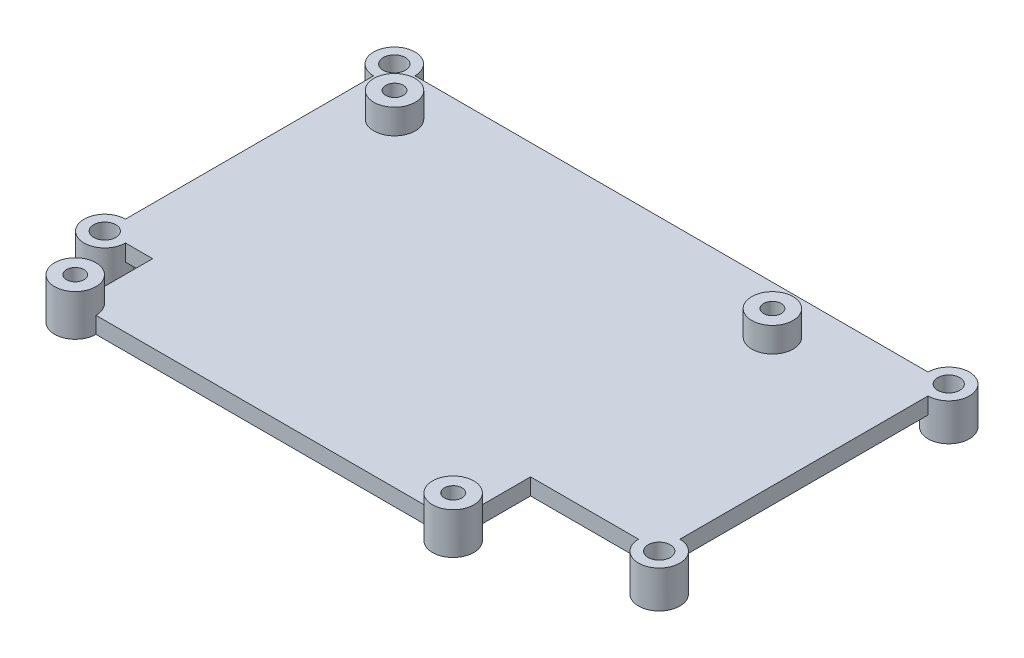
from build123d import *

# Parameters (mm, degrees)
SKETCH3_R           = 1.7
SKETCH3_R_2         = 1.35
BOSS_EXTRUDE2_DEPTH = 2.54
BOSS_EXTRUDE3_START = -3.175
SKETCH3_3_R         = 1.7
SKETCH3_3_R_2       = 3.175
BOSS_EXTRUDE3_DEPTH = 3.175
SKETCH3_4_R         = 3.175
SKETCH3_4_R_2       = 1.35
BOSS_EXTRUDE4_DEPTH = 6.35


with BuildPart() as part:
    # Sketch3 → Boss-Extrude2 (new body)
    with BuildSketch(Plane(origin=(0, 0, 0), x_dir=(1, 0, 0), z_dir=(0, 1, 0))):
        with BuildLine():
            Line((96.195997268, -106.660124546), (100.361892412, -106.660124546))
            Line((100.361892412, -106.660124546), (100.361892412, -115.360172993))
            ThreePointArc((100.361892412, -115.360172993), (98.116828382, -120.780237023), (103.536892412, -118.535172993))
            Line((103.536892412, -118.535172993), (155.186892412, -118.535172993))
            ThreePointArc((155.186892412, -118.535172993), (160.606956442, -120.780237023), (158.361892412, -115.360172993))
            Line((158.361892412, -115.360172993), (158.361892412, -106.660124546))
            Line((158.361892412, -106.660124546), (174.935999752, -106.660124546))
            ThreePointArc((174.935999752, -106.660124546), (180.356063783, -108.905188576), (178.110999752, -103.485124546))
            Line((178.110999752, -103.485124546), (178.110999752, -65.396123892))
            ThreePointArc((178.110999752, -65.396123892), (180.351769569, -59.973882777), (174.933888023, -62.225172993))
            Line((174.933888023, -62.225172993), (96.193885538, -62.225172993))
            ThreePointArc((96.193885538, -62.225172993), (90.773821508, -59.980108963), (93.018885538, -65.400172993))
            Line((93.018885538, -65.400172993), (93.018885538, -103.489173646))
            ThreePointArc((93.018885538, -103.489173646), (90.776683465, -108.90998437), (96.195999849, -106.664172943))
            Line((96.195999849, -106.664172943), (96.195999845, -106.664021883))
            ThreePointArc((96.195999845, -106.664021883), (96.195999154, -106.662073214), (96.195997268, -106.660124546))
        make_face()
        with Locations((93.020999849, -106.664172943)):
            Circle(SKETCH3_R, mode=Mode.SUBTRACT)
        with Locations((93.018885538, -62.225172993)):
            Circle(SKETCH3_R, mode=Mode.SUBTRACT)
        with Locations((178.108885442, -62.221124596)):
            Circle(SKETCH3_R, mode=Mode.SUBTRACT)
        with Locations((178.110999752, -106.660124546)):
            Circle(SKETCH3_R, mode=Mode.SUBTRACT)
        with Locations((158.361892412, -118.535172993)):
            Circle(SKETCH3_R_2, mode=Mode.SUBTRACT)
        with Locations((100.361892412, -118.535172993)):
            Circle(SKETCH3_R_2, mode=Mode.SUBTRACT)
        with Locations((100.361892412, -69.535172993)):
            Circle(SKETCH3_R_2, mode=Mode.SUBTRACT)
        with Locations((158.361892412, -69.535172993)):
            Circle(SKETCH3_R_2, mode=Mode.SUBTRACT)
    extrude(amount=BOSS_EXTRUDE2_DEPTH)

    # Sketch3<3> → Boss-Extrude3 (add)
    # profile 1 of 4: a face of its own
    with BuildSketch(Plane(origin=(0, 0, 0), x_dir=(1, 0, 0), z_dir=(0, 1, 0)).offset(BOSS_EXTRUDE3_START)):
        with BuildLine():
            ThreePointArc((96.195999845, -106.664021883), (89.84599985, -106.664248472), (96.195999849, -106.664172943))
            Line((96.195999849, -106.664172943), (96.195999845, -106.664021883))
        make_face()
        with Locations((93.020999849, -106.664172943)):
            Circle(SKETCH3_3_R, mode=Mode.SUBTRACT)
    # profile 2 of 4: a face of its own
    with BuildSketch(Plane(origin=(0, 0, 0), x_dir=(1, 0, 0), z_dir=(0, 1, 0)).offset(BOSS_EXTRUDE3_START)):
        with Locations((93.018885538, -62.225172993)):
            Circle(SKETCH3_3_R_2)
        with Locations((93.018885538, -62.225172993)):
            Circle(SKETCH3_3_R, mode=Mode.SUBTRACT)
    # profile 3 of 4: a face of its own
    with BuildSketch(Plane(origin=(0, 0, 0), x_dir=(1, 0, 0), z_dir=(0, 1, 0)).offset(BOSS_EXTRUDE3_START)):
        with Locations((178.108885442, -62.221124596)):
            Circle(SKETCH3_3_R_2)
        with Locations((178.108885442, -62.221124596)):
            Circle(SKETCH3_3_R, mode=Mode.SUBTRACT)
    # profile 4 of 4: a face of its own
    with BuildSketch(Plane(origin=(0, 0, 0), x_dir=(1, 0, 0), z_dir=(0, 1, 0)).offset(BOSS_EXTRUDE3_START)):
        with Locations((178.110999752, -106.660124546)):
            Circle(SKETCH3_3_R_2)
        with Locations((178.110999752, -106.660124546)):
            Circle(SKETCH3_3_R, mode=Mode.SUBTRACT)
    extrude(amount=BOSS_EXTRUDE3_DEPTH)

    # Sketch3<4> → Boss-Extrude4 (add)
    # profile 1 of 4: a face of its own
    with BuildSketch(Plane(origin=(0, 0, 0), x_dir=(1, 0, 0), z_dir=(0, 1, 0))):
        with Locations((100.361892412, -118.535172993)):
            Circle(SKETCH3_4_R)
        with Locations((100.361892412, -118.535172993)):
            Circle(SKETCH3_4_R_2, mode=Mode.SUBTRACT)
    # profile 2 of 4: a face of its own
    with BuildSketch(Plane(origin=(0, 0, 0), x_dir=(1, 0, 0), z_dir=(0, 1, 0))):
        with Locations((158.361892412, -118.535172993)):
            Circle(SKETCH3_4_R)
        with Locations((158.361892412, -118.535172993)):
            Circle(SKETCH3_4_R_2, mode=Mode.SUBTRACT)
    # profile 3 of 4: a face of its own
    with BuildSketch(Plane(origin=(0, 0, 0), x_dir=(1, 0, 0), z_dir=(0, 1, 0))):
        with Locations((100.361892412, -69.535172993)):
            Circle(SKETCH3_4_R)
        with Locations((100.361892412, -69.535172993)):
            Circle(SKETCH3_4_R_2, mode=Mode.SUBTRACT)
    # profile 4 of 4: a face of its own
    with BuildSketch(Plane(origin=(0, 0, 0), x_dir=(1, 0, 0), z_dir=(0, 1, 0))):
        with Locations((158.361892412, -69.535172993)):
            Circle(SKETCH3_4_R)
        with Locations((158.361892412, -69.535172993)):
            Circle(SKETCH3_4_R_2, mode=Mode.SUBTRACT)
    extrude(amount=BOSS_EXTRUDE4_DEPTH)


solid = part.part
